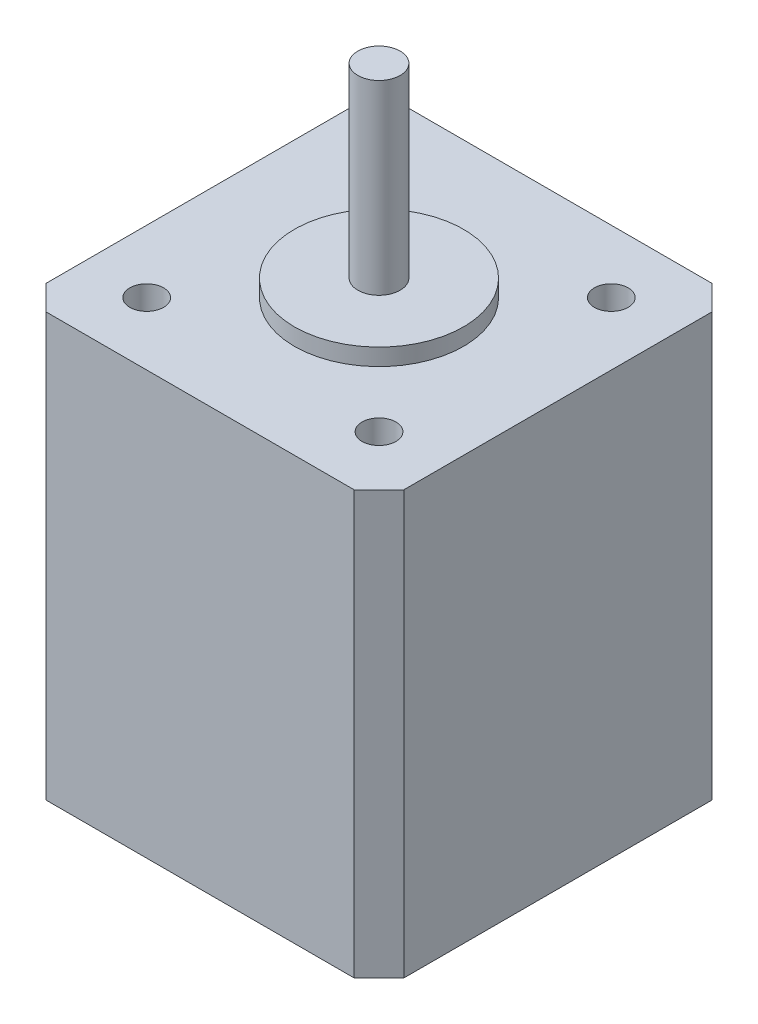
from build123d import *

# Parameters (mm, degrees)
SKETCH_1_R      = 10
EXTRUDE_2_DEPTH = 2
SKETCH_1_6_R    = 2
EXTRUDE_5_DEPTH = 50
SKETCH_8_W      = 6.431791907
SKETCH_8_H      = 4.68965636
SKETCH_8_W_2    = 4.511669879
SKETCH_8_H_2    = 3.190584844
EXTRUDE_7_DEPTH = 5
SKETCH_10_R     = 0.2
EXTRUDE_8_DEPTH = 4
SKETCH_11_R     = 2.5
EXTRUDE_9_DEPTH = 22


with BuildPart() as part:
    # 草图1 → 凸台-拉伸2 (new body)
    with BuildSketch(Plane(origin=(0, 0, 0), x_dir=(1, 0, 0), z_dir=(0, 1, 0))):
        with Locations((5.012427746, -3.423121387)):
            Circle(SKETCH_1_R)
    extrude(amount=EXTRUDE_2_DEPTH)

    # 草图1<6> → 凸台-拉伸5 (add)
    with BuildSketch(Plane(origin=(0, 0, 0), x_dir=(1, 0, 0), z_dir=(0, 1, 0))):
        Polygon((-16.137572254, -21.639017341), (-16.137572254, 14.792774566), (-13.203468208, 17.726878613), (23.228323699, 17.726878613), (26.162427746, 14.792774566), (26.162427746, -21.639017341), (23.228323699, -24.573121387), (-13.203468208, -24.573121387), align=None)
        with Locations((-8.722572254, -17.158121387)):
            Circle(SKETCH_1_6_R, mode=Mode.SUBTRACT)
        with Locations((-8.722572254, 10.311878613)):
            Circle(SKETCH_1_6_R, mode=Mode.SUBTRACT)
        with Locations((18.747427746, -17.158121387)):
            Circle(SKETCH_1_6_R, mode=Mode.SUBTRACT)
        with Locations((18.747427746, 10.311878613)):
            Circle(SKETCH_1_6_R, mode=Mode.SUBTRACT)
    extrude(amount=-EXTRUDE_5_DEPTH)

    # 草图8 → 凸台-拉伸7 (add)
    with BuildSketch(Plane(origin=(0, 0, -17.726878613), x_dir=(-1, 0, 0), z_dir=(0, 0, -1))):
        with Locations((-5.012427746, -47.65517182)):
            Rectangle(SKETCH_8_W, SKETCH_8_H)
        with Locations((-5.085720746, -47.740684826)):
            Rectangle(SKETCH_8_W_2, SKETCH_8_H_2, mode=Mode.SUBTRACT)
    extrude(amount=EXTRUDE_7_DEPTH)

    # 草图10 → 凸台-拉伸8 (add)
    with BuildSketch(Plane(origin=(0, 0, -17.726878613), x_dir=(-1, 0, 0), z_dir=(0, 0, -1))):
        with Locations((-6.597292785, -47.769314004)):
            Circle(SKETCH_10_R)
        with Locations((-5.521254618, -47.769314004)):
            Circle(SKETCH_10_R)
        with Locations((-4.574749057, -47.769314004)):
            Circle(SKETCH_10_R)
        with Locations((-3.590639555, -47.769314004)):
            Circle(SKETCH_10_R)
    extrude(amount=EXTRUDE_8_DEPTH)

    # 草图11 → 凸台-拉伸9 (add)
    with BuildSketch(Plane(origin=(0, 2, 0), x_dir=(1, 0, 0), z_dir=(0, 1, 0))):
        with Locations((5.012427746, -3.423121387)):
            Circle(SKETCH_11_R)
    extrude(amount=EXTRUDE_9_DEPTH)


solid = part.part
